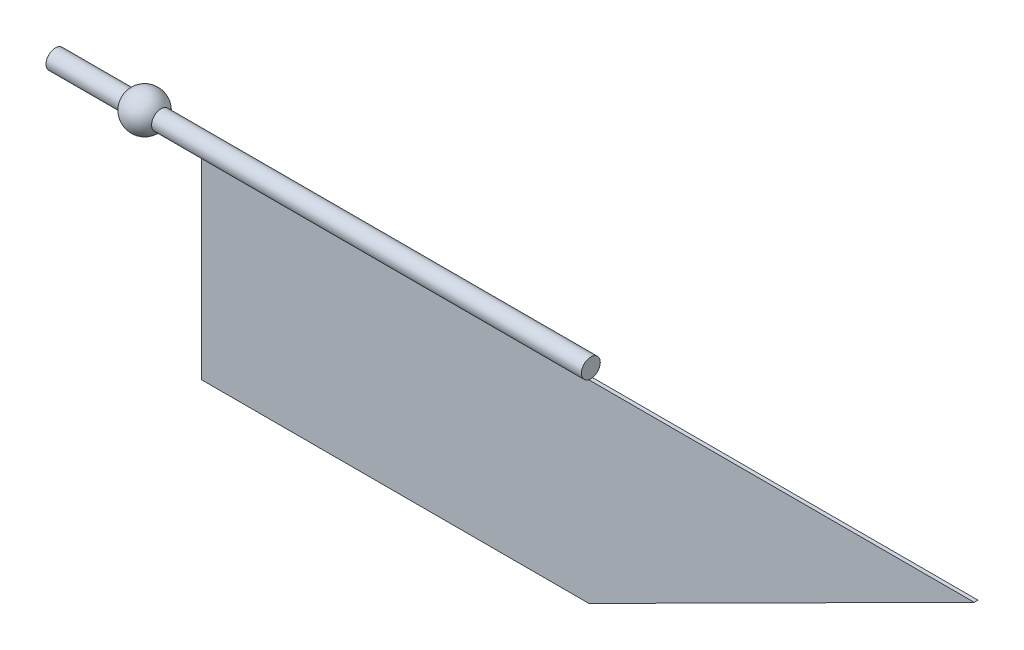
from build123d import *

# Parameters (mm, degrees)
SKETCH2_W           = 26.015295186
SKETCH2_H           = 12.997707743
BOSS_EXTRUDE1_DEPTH = 0.127


with BuildPart() as part:
    # Sketch1 → Revolve1 (revolve)
    with BuildSketch(Plane.XY, mode=Mode.PRIVATE) as revolve1_sk:
        with BuildLine():
            Line((7.086533119, 0), (4.886828594, 0))
            ThreePointArc((4.886828594, 0), (5.986680857, -0.635), (7.086533119, 0))
        make_face()
        with BuildLine():
            ThreePointArc((4.716680857, 0.635), (4.759955057, 0.306299813), (4.886828594, 0))
            Line((4.886828594, 0), (7.086533119, 0))
            ThreePointArc((7.086533119, 0), (7.213406656, 0.306299813), (7.256680857, 0.635))
            Line((7.256680857, 0.635), (4.716680857, 0.635))
        make_face()
        with BuildLine():
            Line((0, 0.635), (0, 0))
            Line((0, 0), (4.886828594, 0))
            ThreePointArc((4.886828594, 0), (4.759955057, 0.306299813), (4.716680857, 0.635))
            Line((4.716680857, 0.635), (0, 0.635))
        make_face()
        with BuildLine():
            ThreePointArc((7.256680857, 0.635), (7.213406656, 0.306299813), (7.086533119, 0))
            Line((7.086533119, 0), (35.936514965, 0))
            Line((35.936514965, 0), (35.936514965, 0.635))
            Line((35.936514965, 0.635), (7.256680857, 0.635))
        make_face()
    revolve(revolve1_sk.sketch.rotate(Axis((35.936514965, 0.635, 0), (-1, 0, 0)), 180), axis=Axis((35.936514965, 0.635, 0), (-1, 0, 0)))


with BuildPart() as body_2:
    # Sketch2 → Boss-Extrude1 (new, symmetric)
    with BuildSketch(Plane.XY):
        Polygon((35.936514965, -12.997707743), (61.800281192, 0), (35.936514965, 0), align=None)
        with Locations((22.928867372, -6.498853872)):
            Rectangle(SKETCH2_W, SKETCH2_H)
    extrude(amount=BOSS_EXTRUDE1_DEPTH, both=True)


solid = Compound([part.part, body_2.part])
